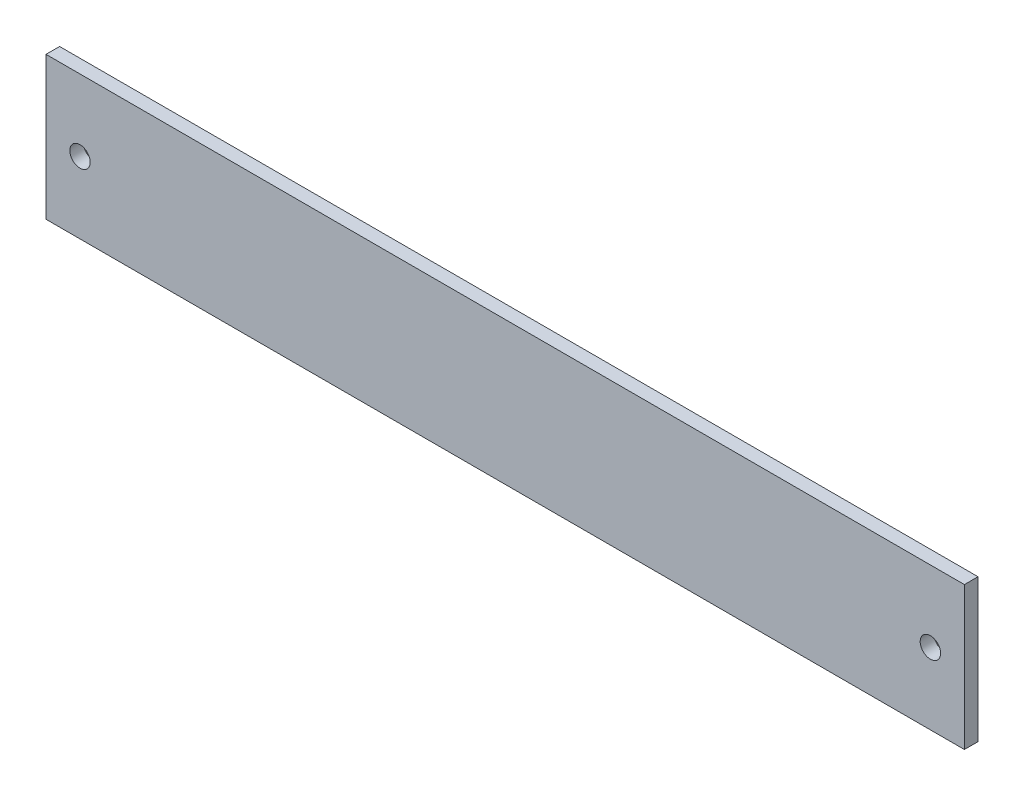
from build123d import *

# Parameters (mm, degrees)
SKETCH1_W           = 135
SKETCH1_H           = 21
SKETCH1_R           = 1.5
BOSS_EXTRUDE1_DEPTH = 2


with BuildPart() as part:
    # Sketch1 → Boss-Extrude1 (new body)
    with BuildSketch(Plane.XY):
        Rectangle(SKETCH1_W, SKETCH1_H)
        with Locations((-62.5, 0)):
            Circle(SKETCH1_R, mode=Mode.SUBTRACT)
        with Locations((62.5, 0)):
            Circle(SKETCH1_R, mode=Mode.SUBTRACT)
    extrude(amount=BOSS_EXTRUDE1_DEPTH)


solid = part.part
